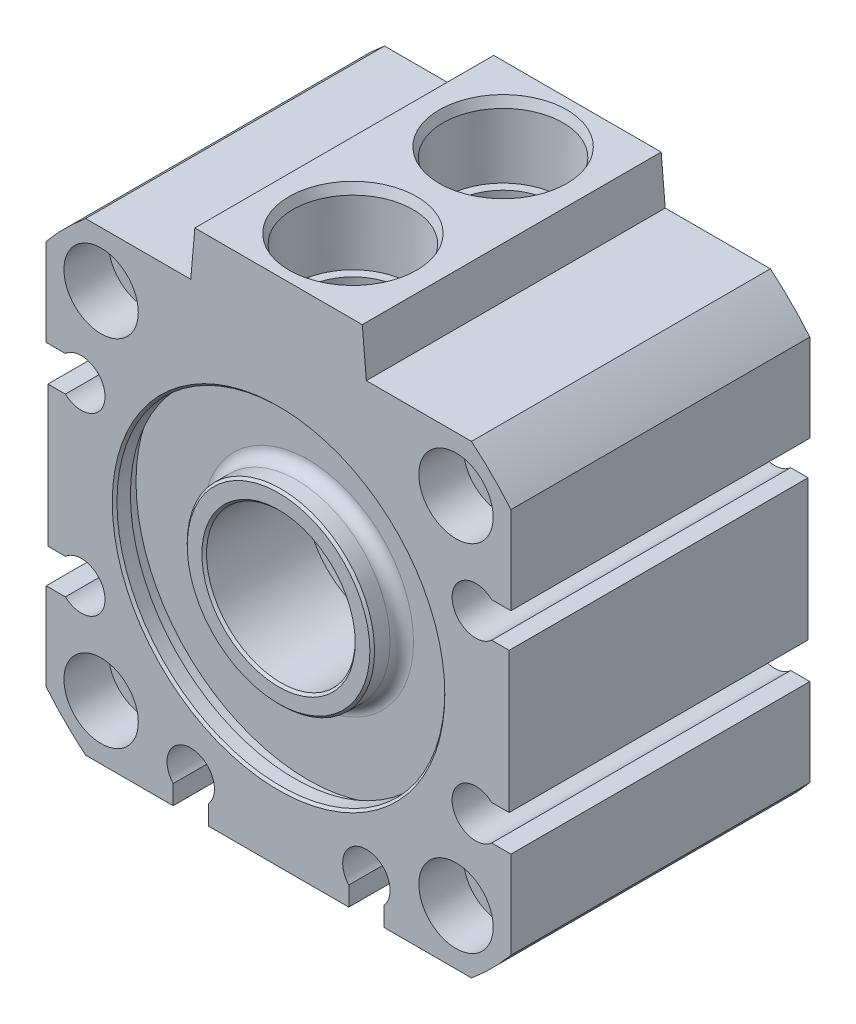
from build123d import *

# Parameters (mm, degrees)
EXTRUDE1_DEPTH                               = 12.7635
EXTRUDE1_DEPTH_BACK                          = 12.7635
SKETCH1_W                                    = 39.69
SKETCH1_H                                    = 39.69
F_056_250_NOSE_CHAMFER_R                     = 1
SKETCH13_R                                   = 28.065068145
SKETCH13_R_2                                 = 25.795
F_075_250_TUBE_EDGE_ROUNDOVER_DEPTH          = 38.937788272
F_075_250_PORT_BOSS_DEPTH                    = 25.527
F_106_200_PORT_1_8_NPT_AT_2_COUNT            = 2
F_106_200_PORT_1_8_NPT_AT_2_PITCH            = 12.827
F_075_250_SWITCH_GROOVE_DEPTH                = 41.157265582
F_075_106_SWITCH_GROOVE_CIRC_PATTERN_COUNT   = 3
F_075_106_SWITCH_GROOVE_CIRC_PATTERN_ANGLE   = 180
SKETCH19_W                                   = 0.15
SKETCH19_H                                   = 12
F_075_250_THIN_SIDE_CUTS_DEPTH               = 41.157265582
SKETCH20_R                                   = 1.95
F_075_250_MOUNT_THRU_HOLE_DEPTH              = 41.157265582
F_075_250_MOUNT_THRU_HOLE_CIRC_PATTERN_COUNT = 4
SKETCH21_R                                   = 3.175
F_075_250_B_MOUNT_CBORE_ROD_END_DEPTH        = 3.81
F_056_250_START                              = -4.0875
SKETCH22_R                                   = 13.462
F_056_250_STROKE_CHAMBER_DEPTH               = 8.175
SKETCH23_R                                   = 6.35
F_056_250_ROD_THRU_BORE_DEPTH                = 34.524396822
F_056_250_COLLAR_CHAMFER_SIZE                = 0.2


with BuildPart() as part:
    # Sketch1 → Extrude1 (new, two sides: drawn at the far end of the back side and taken through both)
    with BuildSketch(Plane.XY.offset(-EXTRUDE1_DEPTH_BACK)):
        Rectangle(SKETCH1_W, SKETCH1_H)
    extrude(amount=EXTRUDE1_DEPTH + EXTRUDE1_DEPTH_BACK)

    # Sketch33 → 056-250 Front Recess (revolve, cut)
    with BuildSketch(Plane(origin=(0, 0, 0), x_dir=(0, 0, -1), z_dir=(1, 0, 0)), mode=Mode.PRIVATE) as f_056_250_front_recess_sk:
        Polygon((-12.7635, 14), (-11.4135, 14), (-11.4135, 14.7), (-10.2385, 14.7), (-10.2385, 8), (-12.7635, 8), align=None)
    revolve(f_056_250_front_recess_sk.sketch.rotate(Axis((0, 0, 61.220394237), (0, 0, -1)), 90), axis=Axis((0, 0, 61.220394237), (0, 0, -1)), mode=Mode.SUBTRACT)

    # 056-250 Nose Chamfer
    f_056_250_nose_chamfer_edges = [part.edges().sort_by_distance(p)[0] for p in [
        (-8, 0, 10.2385),
    ]]
    fillet(f_056_250_nose_chamfer_edges, radius=F_056_250_NOSE_CHAMFER_R)

    # Sketch13 → 075-250 Tube Edge Roundover (cut, through all)
    with BuildSketch(Plane.XY.offset(12.7635)):
        Circle(SKETCH13_R)
        Circle(SKETCH13_R_2, mode=Mode.SUBTRACT)
    extrude(amount=-F_075_250_TUBE_EDGE_ROUNDOVER_DEPTH, mode=Mode.SUBTRACT)

    # Sketch14 → 075-250 Port Boss (add)
    with BuildSketch(Plane.XY.offset(12.7635)):
        Polygon((-7.15, 23.815), (7.15, 23.815), (7.497329994, 19.845), (-7.497329994, 19.845), align=None)
    extrude(amount=-F_075_250_PORT_BOSS_DEPTH)

    # Sketch36 → 106-200 Port 1/8 NPT (revolve, cut)
    with BuildSketch(Plane(origin=(0, 23.815, 6.4135), x_dir=(0, 0, 1), z_dir=(1, 0, 0))):
        Polygon((0, 0), (0, 10.533468714), (4.2164, 8), (4.2164, 6.2), (4.959907269, 6.2), (5.1218211, 0.792298297), (5.4500018, 0), align=None)
    f_106_200_port_1_8_npt = revolve(axis=Axis((0, 30.165, 6.4135), (0, -1, 0)), mode=Mode.SUBTRACT)

    # 106-200 Port 1/8 NPT at 2: 106-200 Port 1/8 NPT ×2
    with Locations(*[(0, 0, -i * F_106_200_PORT_1_8_NPT_AT_2_PITCH) for i in range(1, F_106_200_PORT_1_8_NPT_AT_2_COUNT)]):
        add(f_106_200_port_1_8_npt, mode=Mode.SUBTRACT)

    # Sketch15 → 075-250 Switch Groove (cut, through all)
    with BuildSketch(Plane.XY.offset(12.7635)):
        with BuildLine():
            Line((-19.845, 9), (-18.205376786, 9))
            ThreePointArc((-18.205376786, 9), (-14.82, 7.5), (-18.205376786, 6))
            Line((-18.205376786, 6), (-19.845, 6))
            Line((-19.845, 6), (-19.845, 9))
        make_face()
        with BuildLine():
            Line((-19.845, -9), (-19.845, -6))
            Line((-19.845, -6), (-18.205376786, -6))
            ThreePointArc((-18.205376786, -6), (-14.82, -7.5), (-18.205376786, -9))
            Line((-18.205376786, -9), (-19.845, -9))
        make_face()
    f_075_250_switch_groove = extrude(amount=-F_075_250_SWITCH_GROOVE_DEPTH, mode=Mode.SUBTRACT)

    # 075-106 Switch Groove Circ Pattern: 075-250 Switch Groove ×3 about axis
    f_075_106_switch_groove_circ_pattern_axis = Axis((0, 0, 0), (0, 0, 1))
    for i in range(1, F_075_106_SWITCH_GROOVE_CIRC_PATTERN_COUNT):
        add(f_075_250_switch_groove.rotate(f_075_106_switch_groove_circ_pattern_axis, i * F_075_106_SWITCH_GROOVE_CIRC_PATTERN_ANGLE / (F_075_106_SWITCH_GROOVE_CIRC_PATTERN_COUNT - 1)), mode=Mode.SUBTRACT)

    # Sketch19 → 075-250 Thin Side Cuts (cut, through all)
    with BuildSketch(Plane.XY.offset(12.7635)):
        with Locations((19.77, 0)):
            Rectangle(SKETCH19_W, SKETCH19_H)
        with Locations((-19.77, 0)):
            Rectangle(SKETCH19_W, SKETCH19_H)
    extrude(amount=-F_075_250_THIN_SIDE_CUTS_DEPTH, mode=Mode.SUBTRACT)

    # Sketch20 → 075-250 Mount Thru Hole (cut, through all)
    with BuildSketch(Plane.XY.offset(12.7635)):
        with Locations((15.155, 15.155)):
            Circle(SKETCH20_R)
    f_075_250_mount_thru_hole = extrude(amount=-F_075_250_MOUNT_THRU_HOLE_DEPTH, mode=Mode.SUBTRACT)

    # 075-250 Mount Thru Hole Circ Pattern: 075-250 Mount Thru Hole ×4 about axis
    f_075_250_mount_thru_hole_circ_pattern_axis = Axis((0, 0, 0), (0, 0, 1))
    for i in range(1, F_075_250_MOUNT_THRU_HOLE_CIRC_PATTERN_COUNT):
        add(f_075_250_mount_thru_hole.rotate(f_075_250_mount_thru_hole_circ_pattern_axis, i * 360 / F_075_250_MOUNT_THRU_HOLE_CIRC_PATTERN_COUNT), mode=Mode.SUBTRACT)

    # Sketch21 → 075-250 B Mount CBore Rod End (cut)
    with BuildSketch(Plane.XY.offset(12.7635)):
        with Locations((-15.155, 15.155)):
            Circle(SKETCH21_R)
        with Locations((-15.155, -15.155)):
            Circle(SKETCH21_R)
        with Locations((15.155, 15.155)):
            Circle(SKETCH21_R)
        with Locations((15.155, -15.155)):
            Circle(SKETCH21_R)
    f_075_250_b_mount_cbore_rod_end = extrude(amount=-F_075_250_B_MOUNT_CBORE_ROD_END_DEPTH, mode=Mode.SUBTRACT)

    # 075-250 B Mount CBore Non-Rod End: 075-250 B Mount CBore Rod End across plane
    add(f_075_250_b_mount_cbore_rod_end.mirror(Plane.XY), mode=Mode.SUBTRACT)

    # Sketch22 → 056-250 Stroke Chamber (cut)
    with BuildSketch(Plane.XY.offset(F_056_250_START)):
        Circle(SKETCH22_R)
    extrude(amount=F_056_250_STROKE_CHAMBER_DEPTH, mode=Mode.SUBTRACT)

    # Sketch23 → 056-250 Rod Thru Bore (cut, through all)
    with BuildSketch(Plane.XY):
        Circle(SKETCH23_R)
    extrude(amount=F_056_250_ROD_THRU_BORE_DEPTH, mode=Mode.SUBTRACT)

    # 056-250 Collar Chamfer
    f_056_250_collar_chamfer_edges = [part.edges().sort_by_distance(p)[0] for p in [
        (-14, 0, 12.7635),
        (-8, 0, 12.7635),
        (-6.35, 0, 12.7635),
    ]]
    chamfer(f_056_250_collar_chamfer_edges, length=F_056_250_COLLAR_CHAMFER_SIZE)


solid = part.part
